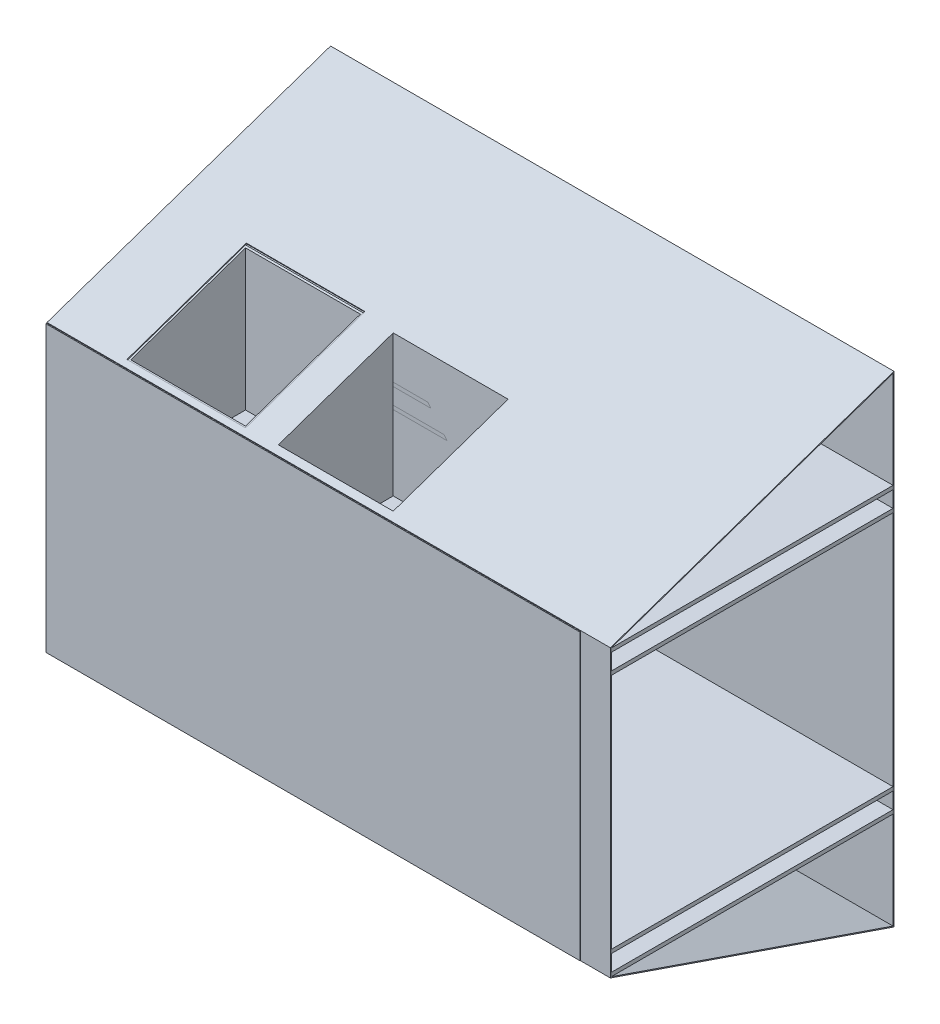
from build123d import *

# Parameters (mm, degrees)
SKETCH1_W                       = 1800
SKETCH1_H                       = 960
BOSS_EXTRUDE1_DEPTH             = 6.35
BOSS_EXTRUDE2_DEPTH             = 1900
SKETCH6_W                       = 400
SKETCH6_H                       = 425.788292868
CUT_EXTRUDE1_DEPTH              = 300
SKETCH7_W                       = 400
SKETCH7_H                       = 425.67110899
CUT_EXTRUDE2_DEPTH              = 300
BOSS_EXTRUDE4_REACH             = 2489.303
SKETCH8_W                       = 400
SKETCH8_H                       = 400
SKETCH8_W_2                     = 387.3
SKETCH8_H_2                     = 387.3
BOSS_EXTRUDE4_DIRECTION_2_REACH = 2489.303
SKETCH11_R                      = 131.35
BOSS_EXTRUDE6_DEPTH             = 30
SKETCH12_R                      = 125
CUT_EXTRUDE5_DEPTH              = 20
BOSS_EXTRUDE7_REACH             = 2489.303
SKETCH14_W                      = 400
SKETCH14_H                      = 400
SKETCH14_W_2                    = 387.3
SKETCH14_H_2                    = 387.3
BOSS_EXTRUDE7_DIRECTION_2_REACH = 2489.303
CUT_EXTRUDE6_START              = -1104.02001
SKETCH15_W                      = 387.3
SKETCH15_H                      = 387.3
CUT_EXTRUDE6_DEPTH              = 1248.04002
SKETCH16_W                      = 400
SKETCH16_H                      = 200
CUT_EXTRUDE8_DEPTH              = 940
SKETCH18_W                      = 4.075824643
SKETCH18_H                      = 122.071298875
CUT_EXTRUDE9_DEPTH              = 410
SKETCH19_W                      = 387.3
SKETCH19_H                      = 387.3
BOSS_EXTRUDE22_DEPTH            = 10
SKETCH22_W                      = 387.3
SKETCH22_H                      = 389.400481364
BOSS_EXTRUDE24_DEPTH            = 10
SKETCH23_W                      = 387.3
SKETCH23_H                      = 387.3
BOSS_EXTRUDE25_DEPTH            = 10
SKETCH24_W                      = 387.3
SKETCH24_H                      = 387.3
BOSS_EXTRUDE26_DEPTH            = 10
SKETCH25_W                      = 950
SKETCH25_H                      = 12.7
BOSS_EXTRUDE27_DEPTH            = 1900
SKETCH26_W                      = 387.3
SKETCH26_H                      = 387.3
CUT_EXTRUDE10_DEPTH             = 300
SKETCH27_W                      = 387.3
SKETCH27_H                      = 387.3
CUT_EXTRUDE11_DEPTH             = 300
SKETCH28_W                      = 387.3
SKETCH28_H                      = 387.3
CUT_EXTRUDE12_DEPTH             = 300
SKETCH29_W                      = 387.3
SKETCH29_H                      = 387.3
CUT_EXTRUDE13_DEPTH             = 300
SKETCH30_R                      = 11.146802018
CUT_EXTRUDE14_DEPTH             = 10


with BuildPart() as part:
    # Sketch1 → Boss-Extrude1 (new body)
    with BuildSketch(Plane.XY):
        with Locations((900, -480)):
            Rectangle(SKETCH1_W, SKETCH1_H)
    extrude(amount=BOSS_EXTRUDE1_DEPTH)

    # Sketch2 → Boss-Extrude2 (add)
    with BuildSketch(Plane(origin=(0, 0, 0), x_dir=(0, 0, -1), z_dir=(1, 0, 0))):
        Polygon((-3.175, -962.264705491), (-3.175, 2.264705491), (953.175, 331.56241846), (953.175, -1291.56241846), align=None)
        Polygon((0, 0), (950, 327.111232625), (950, -1287.111232625), (0, -960), align=None, mode=Mode.SUBTRACT)
    extrude(amount=BOSS_EXTRUDE2_DEPTH)

    # Sketch6 → Cut-Extrude1 (cut)
    with BuildSketch(Plane(origin=(0, 3.002021478, 1.03367889), x_dir=(1, 0, 0), z_dir=(0, 0.9455185755993153, 0.32556815445716086))):
        with Locations((449.631164922, 231.795224093)):
            Rectangle(SKETCH6_W, SKETCH6_H)
    extrude(amount=-CUT_EXTRUDE1_DEPTH, mode=Mode.SUBTRACT)

    # Sketch7 → Cut-Extrude2 (cut)
    with BuildSketch(Plane(origin=(0, -861.247183209, 296.551187047), x_dir=(1, 0, 0), z_dir=(0, -0.9455185755993154, 0.32556815445716053))):
        with Locations((449.631164922, -584.134563657)):
            Rectangle(SKETCH7_W, SKETCH7_H)
    extrude(amount=-CUT_EXTRUDE2_DEPTH, mode=Mode.SUBTRACT)

    # Sketch11 → Boss-Extrude6 (add)
    with BuildSketch(Plane(origin=(0, 0, -953.175), x_dir=(-1, 0, 0), z_dir=(0, 0, -1))):
        with Locations(Location((-350, -492.20758154, 0), (0, 0, 90))):
            Circle(SKETCH11_R)
    extrude(amount=-BOSS_EXTRUDE6_DEPTH)

    # Sketch12 → Cut-Extrude5 (cut)
    with BuildSketch(Plane(origin=(0, 0, -953.175), x_dir=(-1, 0, 0), z_dir=(0, 0, -1))):
        with Locations(Location((-350, -492.20758154, 0), (0, 0, 90))):
            Circle(SKETCH12_R)
    extrude(amount=-CUT_EXTRUDE5_DEPTH, mode=Mode.SUBTRACT)

    # Boss-Extrude7: up to this plane
    boss_extrude7_end = Plane(origin=(1900, 0, 0), z_dir=(0, -0.9455185755993153, -0.325568154457161))
    # Sketch14 → Boss-Extrude7 (add, up to the surface)
    with BuildSketch(Plane(origin=(0, 0, 0), x_dir=(1, 0, 0), z_dir=(0, 1, 0)), mode=Mode.PRIVATE) as boss_extrude7_sk1:
        with Locations((949.631164922, 212.761816492)):
            Rectangle(SKETCH14_W, SKETCH14_H)
        with Locations((949.631164922, 212.761816492)):
            Rectangle(SKETCH14_W_2, SKETCH14_H_2, mode=Mode.SUBTRACT)
    boss_extrude7_tool1 = split(extrude(boss_extrude7_sk1.sketch, amount=BOSS_EXTRUDE7_REACH, mode=Mode.PRIVATE), bisect_by=boss_extrude7_end, keep=Keep.BOTH, mode=Mode.PRIVATE)
    add(boss_extrude7_tool1.solids().sort_by_distance((949.631165, 0, -407.104962))[0])

    # Boss-Extrude7 direction 2: up to this plane
    boss_extrude7_direction_2_end = Plane(origin=(1900, -1287.111232625, -950), z_dir=(0, 0.9455185755993156, -0.3255681544571603))
    # Sketch14 → Boss-Extrude7 direction 2 (add, up to the surface)
    with BuildSketch(Plane(origin=(0, 0, 0), x_dir=(1, 0, 0), z_dir=(0, 1, 0)), mode=Mode.PRIVATE) as boss_extrude7_direction_2_sk1:
        with Locations((949.631164922, 212.761816492)):
            Rectangle(SKETCH14_W, SKETCH14_H)
        with Locations((949.631164922, 212.761816492)):
            Rectangle(SKETCH14_W_2, SKETCH14_H_2, mode=Mode.SUBTRACT)
    boss_extrude7_direction_2_tool1 = split(extrude(boss_extrude7_direction_2_sk1.sketch, amount=-BOSS_EXTRUDE7_DIRECTION_2_REACH, mode=Mode.PRIVATE), bisect_by=boss_extrude7_direction_2_end, keep=Keep.BOTH, mode=Mode.PRIVATE)
    add(boss_extrude7_direction_2_tool1.solids().sort_by_distance((949.631165, 0, -407.104962))[0])

    # Sketch15 → Cut-Extrude6 (cut)
    with BuildSketch(Plane(origin=(0, 0, 0), x_dir=(1, 0, 0), z_dir=(0, 1, 0)).offset(CUT_EXTRUDE6_START)):
        with Locations((949.631164922, 214.862297856)):
            Rectangle(SKETCH15_W, SKETCH15_H)
    extrude(amount=CUT_EXTRUDE6_DEPTH, mode=Mode.SUBTRACT)


with BuildPart() as body_2:
    # Boss-Extrude4: up to this plane
    boss_extrude4_end = Plane(origin=(1900, -1287.111232625, -950), z_dir=(0, 0.9455185755993156, -0.3255681544571603))
    # Sketch8 → Boss-Extrude4 (new, up to the surface)
    with BuildSketch(Plane(origin=(0, 0, 0), x_dir=(1, 0, 0), z_dir=(0, 1, 0)), mode=Mode.PRIVATE) as boss_extrude4_sk1:
        with Locations((449.631164922, 216.837641135)):
            Rectangle(SKETCH8_W, SKETCH8_H)
        with Locations((449.631164922, 216.837641135)):
            Rectangle(SKETCH8_W_2, SKETCH8_H_2, mode=Mode.SUBTRACT)
    boss_extrude4_tool1 = split(extrude(boss_extrude4_sk1.sketch, amount=-BOSS_EXTRUDE4_REACH, mode=Mode.PRIVATE), bisect_by=boss_extrude4_end, keep=Keep.BOTH, mode=Mode.PRIVATE)
    add(boss_extrude4_tool1.solids().sort_by_distance((449.631165, 0, -22.494495))[0])

    # Boss-Extrude4 direction 2: up to this plane
    boss_extrude4_direction_2_end = Plane(origin=(1900, 0, 0), z_dir=(0, -0.9455185755993153, -0.325568154457161))
    # Sketch8 → Boss-Extrude4 direction 2 (add, up to the surface)
    with BuildSketch(Plane(origin=(0, 0, 0), x_dir=(1, 0, 0), z_dir=(0, 1, 0)), mode=Mode.PRIVATE) as boss_extrude4_direction_2_sk1:
        with Locations((449.631164922, 216.837641135)):
            Rectangle(SKETCH8_W, SKETCH8_H)
        with Locations((449.631164922, 216.837641135)):
            Rectangle(SKETCH8_W_2, SKETCH8_H_2, mode=Mode.SUBTRACT)
    boss_extrude4_direction_2_tool1 = split(extrude(boss_extrude4_direction_2_sk1.sketch, amount=BOSS_EXTRUDE4_DIRECTION_2_REACH, mode=Mode.PRIVATE), bisect_by=boss_extrude4_direction_2_end, keep=Keep.BOTH, mode=Mode.PRIVATE)
    add(boss_extrude4_direction_2_tool1.solids().sort_by_distance((449.631165, 0, -22.494495))[0])


with BuildPart() as cut_extrude8_tool:
    # Sketch16 → Cut-Extrude8 (new body)
    with BuildSketch(Plane.ZY.offset(-249.631164922)):
        with Locations((-216.837641135, -432.198710101)):
            Rectangle(SKETCH16_W, SKETCH16_H)
    extrude(amount=-CUT_EXTRUDE8_DEPTH)


with BuildPart() as part_1:
    add(part.part)

    # Cut-Extrude8: cut by cut_extrude8_tool
    add(cut_extrude8_tool.part, mode=Mode.SUBTRACT)

    # Sketch18 → Cut-Extrude9 (cut)
    with BuildSketch(Plane(origin=(1149.631164922, 0, 0), x_dir=(0, 0, -1), z_dir=(1, 0, 0))):
        with Locations((14.799728814, -471.163060664)):
            Rectangle(SKETCH18_W, SKETCH18_H)
    extrude(amount=-CUT_EXTRUDE9_DEPTH, mode=Mode.SUBTRACT)

    # Sketch30 → Cut-Extrude14 (cut)
    with BuildSketch(Plane(origin=(0, 0, -933.175), x_dir=(-1, 0, 0), z_dir=(0, 0, -1))):
        with Locations(Location((-285, -427.20758154, 0), (0, 0, 90))):
            Circle(SKETCH30_R)
        with Locations(Location((-415, -427.20758154, 0), (0, 0, 90))):
            Circle(SKETCH30_R)
        with Locations(Location((-415, -557.20758154, 0), (0, 0, 90))):
            Circle(SKETCH30_R)
        with Locations(Location((-285, -557.20758154, 0), (0, 0, 90))):
            Circle(SKETCH30_R)
    extrude(amount=-CUT_EXTRUDE14_DEPTH, mode=Mode.SUBTRACT)


with BuildPart() as body_2_1:
    add(body_2.part)

    # Cut-Extrude8: cut by cut_extrude8_tool
    add(cut_extrude8_tool.part, mode=Mode.SUBTRACT)

    # Sketch25 → Boss-Extrude27 (add)
    with BuildSketch(Plane(origin=(0, 0, 0), x_dir=(0, 0, -1), z_dir=(1, 0, 0))):
        with Locations((475, -953.65)):
            Rectangle(SKETCH25_W, SKETCH25_H)
        with Locations((475, -886.35)):
            Rectangle(SKETCH25_W, SKETCH25_H)
        with Locations((475, -73.65)):
            Rectangle(SKETCH25_W, SKETCH25_H)
        with Locations((475, -6.35)):
            Rectangle(SKETCH25_W, SKETCH25_H)
    extrude(amount=BOSS_EXTRUDE27_DEPTH)

    # Sketch26 → Cut-Extrude10 (cut)
    with BuildSketch(Plane(origin=(0, 0, 0), x_dir=(1, 0, 0), z_dir=(0, 1, 0))):
        with Locations((449.631164922, 216.837641135)):
            Rectangle(SKETCH26_W, SKETCH26_H)
    extrude(amount=-CUT_EXTRUDE10_DEPTH, mode=Mode.SUBTRACT)

    # Sketch27 → Cut-Extrude11 (cut)
    with BuildSketch(Plane(origin=(0, 0, 0), x_dir=(1, 0, 0), z_dir=(0, 1, 0))):
        with Locations((949.631164922, 214.862297856)):
            Rectangle(SKETCH27_W, SKETCH27_H)
    extrude(amount=-CUT_EXTRUDE11_DEPTH, mode=Mode.SUBTRACT)

    # Sketch28 → Cut-Extrude12 (cut)
    with BuildSketch(Plane.XZ.offset(960)):
        with Locations((949.631164922, -214.862297856)):
            Rectangle(SKETCH28_W, SKETCH28_H)
    extrude(amount=-CUT_EXTRUDE12_DEPTH, mode=Mode.SUBTRACT)

    # Sketch29 → Cut-Extrude13 (cut)
    with BuildSketch(Plane.XZ.offset(960)):
        with Locations((449.631164922, -216.837641135)):
            Rectangle(SKETCH29_W, SKETCH29_H)
    extrude(amount=-CUT_EXTRUDE13_DEPTH, mode=Mode.SUBTRACT)


with BuildPart() as body_3:
    # Sketch19 → Boss-Extrude22 (new body)
    with BuildSketch(Plane.XZ.offset(332.198710101)):
        with Locations((949.631164922, -214.862297856)):
            Rectangle(SKETCH19_W, SKETCH19_H)
    extrude(amount=BOSS_EXTRUDE22_DEPTH)


with BuildPart() as body_4:
    # Sketch22 → Boss-Extrude24 (new body)
    with BuildSketch(Plane(origin=(0, -532.198710101, 0), x_dir=(1, 0, 0), z_dir=(0, 1, 0))):
        with Locations((949.631164922, 213.812057174)):
            Rectangle(SKETCH22_W, SKETCH22_H)
    extrude(amount=BOSS_EXTRUDE24_DEPTH)


with BuildPart() as body_5:
    # Sketch23 → Boss-Extrude25 (new body)
    with BuildSketch(Plane(origin=(0, -532.198710101, 0), x_dir=(1, 0, 0), z_dir=(0, 1, 0))):
        with Locations((449.631164922, 216.837641135)):
            Rectangle(SKETCH23_W, SKETCH23_H)
    extrude(amount=BOSS_EXTRUDE25_DEPTH)


with BuildPart() as body_6:
    # Sketch24 → Boss-Extrude26 (new body)
    with BuildSketch(Plane.XZ.offset(332.198710101)):
        with Locations((449.631164922, -216.837641135)):
            Rectangle(SKETCH24_W, SKETCH24_H)
    extrude(amount=BOSS_EXTRUDE26_DEPTH)


solid = Compound([part_1.part, body_2_1.part, body_3.part, body_4.part, body_5.part, body_6.part])
